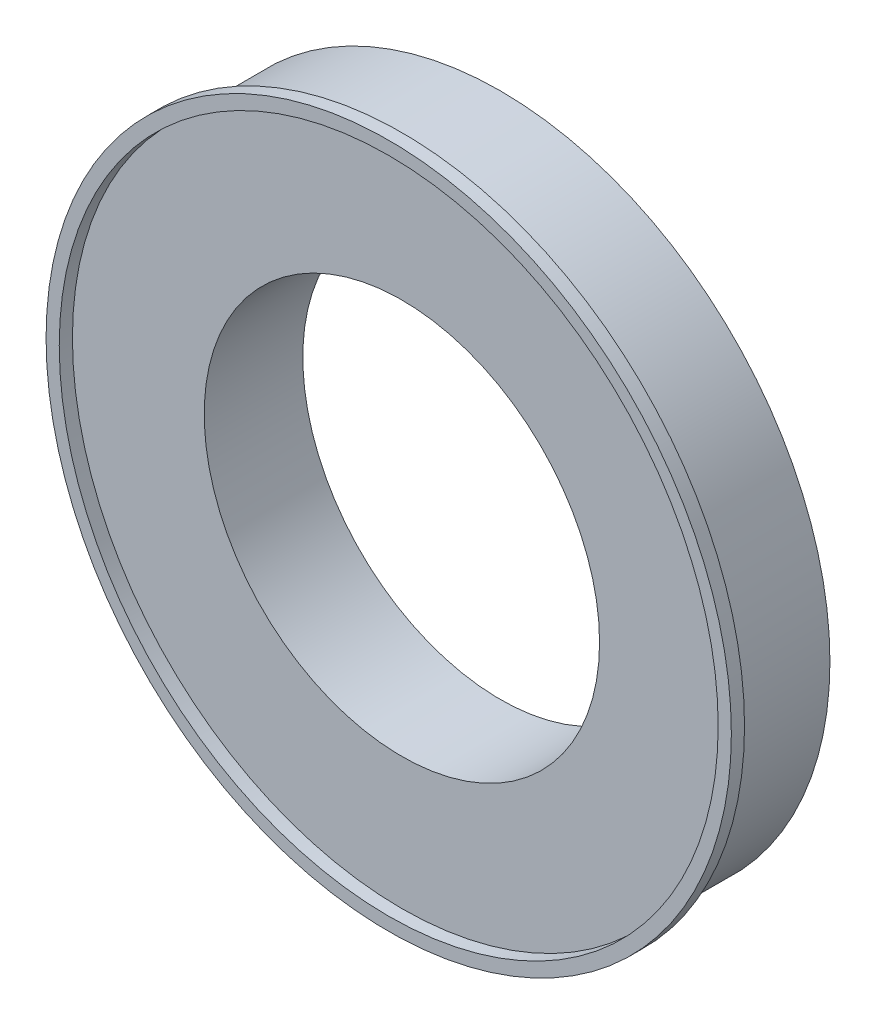
from build123d import *

# Parameters (mm, degrees)
SKETCH1_R           = 63.5
SKETCH1_R_2         = 38.1
BOSS_EXTRUDE1_DEPTH = 9.5
SKETCH2_R           = 66.04
SKETCH2_R_2         = 63.5
BOSS_EXTRUDE2_DEPTH = 2.54


with BuildPart() as part:
    # Sketch1 → Boss-Extrude1 (new, symmetric)
    with BuildSketch(Plane.XY):
        Circle(SKETCH1_R)
        Circle(SKETCH1_R_2, mode=Mode.SUBTRACT)
    extrude(amount=BOSS_EXTRUDE1_DEPTH, both=True)


with BuildPart() as body_2:
    # Sketch2 → Boss-Extrude2 (new body)
    with BuildSketch(Plane.XY.offset(9.5)):
        Circle(SKETCH2_R)
        Circle(SKETCH2_R_2, mode=Mode.SUBTRACT)
    extrude(amount=BOSS_EXTRUDE2_DEPTH)


solid = Compound([part.part, body_2.part])
